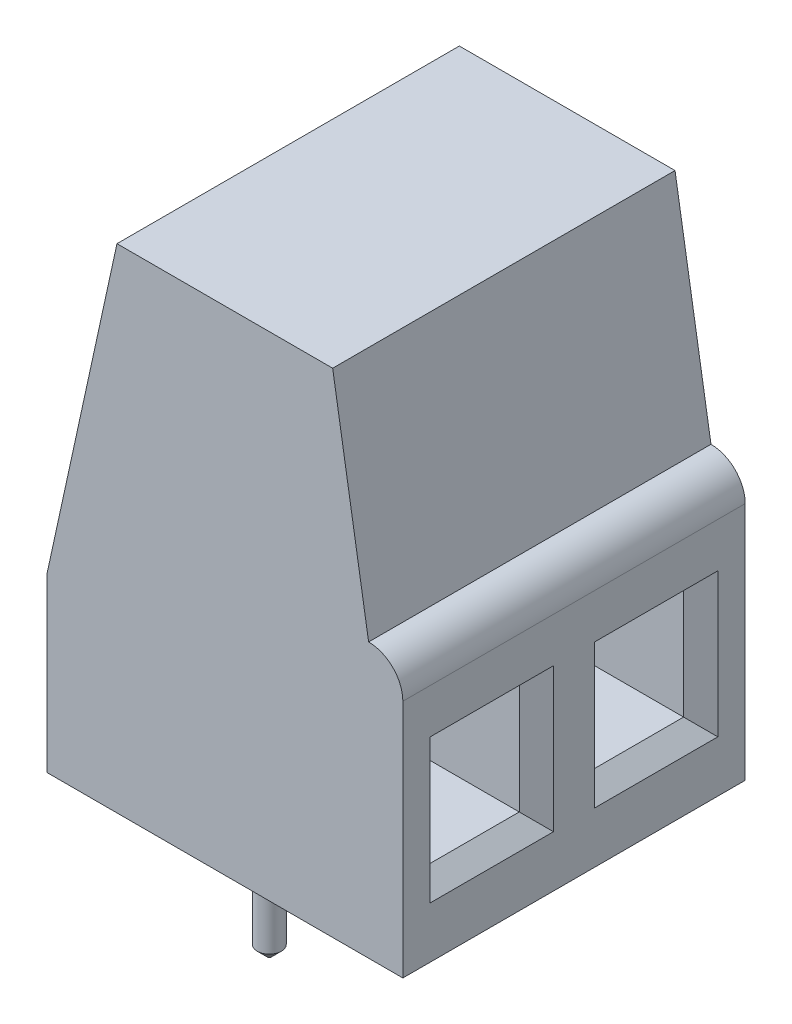
from build123d import *

# Parameters (mm, degrees)
RESSALTO_EXTRUS_O2_DEPTH = 10
ESBO_O4_W                = 2.6
ESBO_O4_H                = 3.2
CORTE_EXTRUS_O1_DEPTH    = 5
CHANFRO2_SIZE            = 0.5
CHANFRO3_SIZE            = 0.5
ESBO_O10_R               = 0.35
RESSALTO_EXTRUS_O5_DEPTH = 3.6
CHANFRO4_SIZE            = 0.3


with BuildPart() as part:
    # Esboço2 → Ressalto-extrusão2 (new body)
    with BuildSketch(Plane.XY):
        with BuildLine():
            Line((0, 0), (10.4, 0))
            Line((10.4, 0), (10.4, 7))
            ThreePointArc((10.4, 7), (10.107106781, 7.707106781), (9.4, 8))
            Line((9.4, 8), (8.35, 14.4))
            Line((8.35, 14.4), (5.2, 14.4))
            Line((5.2, 14.4), (2.05, 14.4))
            Line((2.05, 14.4), (0, 5))
            Line((0, 5), (0, 0))
        make_face()
    extrude(amount=-RESSALTO_EXTRUS_O2_DEPTH)

    # Esboço4 → Corte-extrusão1 (cut)
    with BuildSketch(Plane(origin=(10.4, 0, 0), x_dir=(0, 0, -1), z_dir=(1, 0, 0))):
        with Locations((2.6, 3.6)):
            Rectangle(ESBO_O4_W, ESBO_O4_H)
        with Locations((7.4, 3.6)):
            Rectangle(ESBO_O4_W, ESBO_O4_H)
    extrude(amount=-CORTE_EXTRUS_O1_DEPTH, mode=Mode.SUBTRACT)

    # Chanfro2
    chanfro2_edges = [part.edges().sort_by_distance(p)[0] for p in [
        (10.4, 3.6, -1.3),
        (10.4, 2, -2.6),
        (10.4, 3.6, -3.9),
        (10.4, 5.2, -2.6),
    ]]
    chamfer(chanfro2_edges, length=CHANFRO2_SIZE)

    # Chanfro3
    chanfro3_edges = [part.edges().sort_by_distance(p)[0] for p in [
        (10.4, 3.6, -8.7),
        (10.4, 5.2, -7.4),
        (10.4, 3.6, -6.1),
        (10.4, 2, -7.4),
    ]]
    chamfer(chanfro3_edges, length=CHANFRO3_SIZE)

    # Esboço10 → Ressalto-extrusão5 (add)
    with BuildSketch(Plane.XZ):
        with Locations(Location((4.3, -2.2, 0), (0, 0, 270))):
            Circle(ESBO_O10_R)
        with Locations(Location((4.3, -7.8, 0), (0, 0, 270))):
            Circle(ESBO_O10_R)
    extrude(amount=RESSALTO_EXTRUS_O5_DEPTH)

    # Chanfro4
    chanfro4_edges = [part.edges().sort_by_distance(p)[0] for p in [
        (4.3, -3.6, -1.85),
        (4.3, -3.6, -7.45),
    ]]
    chamfer(chanfro4_edges, length=CHANFRO4_SIZE)


solid = part.part
